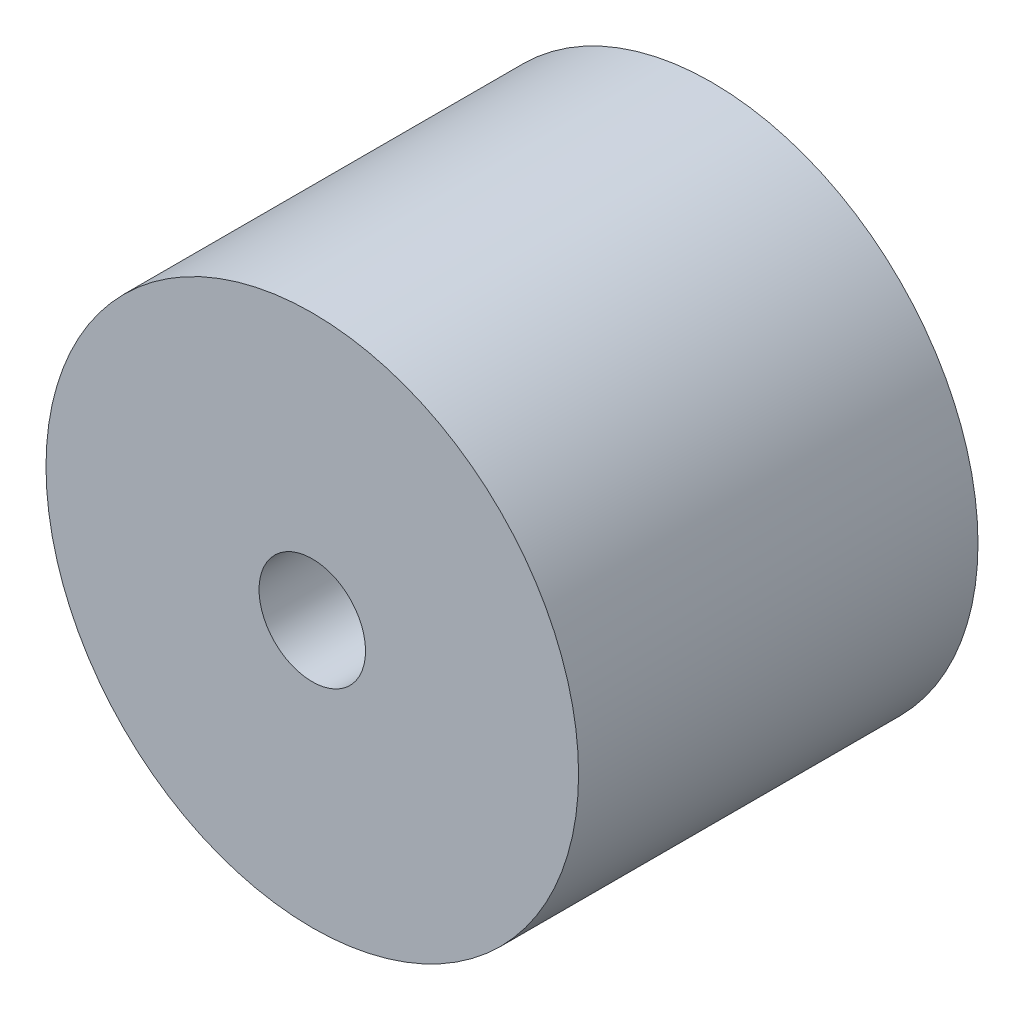
from build123d import *

# Parameters (mm, degrees)
SKETCH_1_R          = 10
EXTRUDE_1_DEPTH     = 15
SKETCH_2_R          = 2
CUT_EXTRUDE_1_DEPTH = 6


with BuildPart() as part:
    # 草图1 → 凸台-拉伸1 (new body)
    with BuildSketch(Plane.XY):
        Circle(SKETCH_1_R)
    extrude(amount=EXTRUDE_1_DEPTH)

    # 草图2 → 切除-拉伸1 (cut)
    with BuildSketch(Plane.XY.offset(15)):
        Circle(SKETCH_2_R)
    extrude(amount=-CUT_EXTRUDE_1_DEPTH, mode=Mode.SUBTRACT)


solid = part.part
